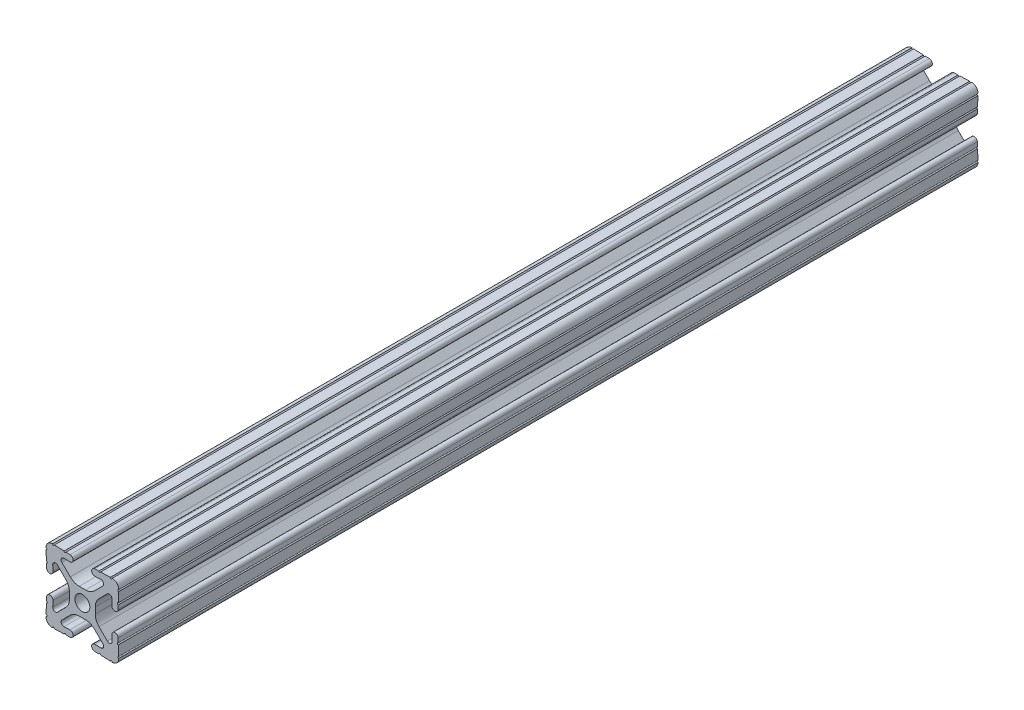
from build123d import *

# Parameters (mm, degrees)
SKETCH3_R      = 2.6035
EXTRUDE1_DEPTH = 150


with BuildPart() as part:
    # Sketch3 → Extrude1 (new, symmetric)
    with BuildSketch(Plane.XY):
        with BuildLine():
            Line((-1.115277175, 4.5085), (1.115277175, 4.5085))
            ThreePointArc((1.115277175, 4.5085), (2.806584872, 4.844922018), (4.240406305, 5.80297087))
            Line((4.240406305, 5.80297087), (7.148423664, 8.710988229))
            ThreePointArc((7.148423664, 8.710988229), (7.349906316, 9.772227925), (6.436353897, 10.348636575))
            Line((6.436353897, 10.348636575), (4.381960454, 10.276895575))
            ThreePointArc((4.381960454, 10.276895575), (3.239173075, 11.342562046), (4.304839546, 12.485349424))
            Line((4.304839546, 12.485349424), (5.728246175, 12.535055879))
            ThreePointArc((5.728246175, 12.535055879), (6.054756855, 12.230579745), (6.35923299, 12.557090424))
            Line((6.35923299, 12.557090424), (9.782092278, 12.676619304))
            ThreePointArc((9.782092278, 12.676619304), (10.108602958, 12.37214317), (10.413079092, 12.69865385))
            ThreePointArc((10.413079092, 12.69865385), (12.052764565, 12.052764565), (12.69865385, 10.413079092))
            ThreePointArc((12.69865385, 10.413079092), (12.37214317, 10.108602958), (12.676619304, 9.782092278))
            Line((12.676619304, 9.782092278), (12.557090424, 6.35923299))
            ThreePointArc((12.557090424, 6.35923299), (12.230579745, 6.054756855), (12.535055879, 5.728246175))
            Line((12.535055879, 5.728246175), (12.485349424, 4.304839546))
            ThreePointArc((12.485349424, 4.304839546), (11.342562046, 3.239173075), (10.276895575, 4.381960454))
            Line((10.276895575, 4.381960454), (10.348636575, 6.436353897))
            ThreePointArc((10.348636575, 6.436353897), (9.772227925, 7.349906316), (8.710988229, 7.148423664))
            Line((8.710988229, 7.148423664), (5.80297087, 4.240406305))
            ThreePointArc((5.80297087, 4.240406305), (4.844922018, 2.806584872), (4.5085, 1.115277175))
            Line((4.5085, 1.115277175), (4.5085, -1.115277175))
            ThreePointArc((4.5085, -1.115277175), (4.844922018, -2.806584872), (5.80297087, -4.240406305))
            Line((5.80297087, -4.240406305), (8.710988229, -7.148423664))
            ThreePointArc((8.710988229, -7.148423664), (9.772227925, -7.349906316), (10.348636575, -6.436353897))
            Line((10.348636575, -6.436353897), (10.276895575, -4.381960454))
            ThreePointArc((10.276895575, -4.381960454), (11.342562046, -3.239173075), (12.485349424, -4.304839546))
            Line((12.485349424, -4.304839546), (12.535055879, -5.728246175))
            ThreePointArc((12.535055879, -5.728246175), (12.230579745, -6.054756855), (12.557090424, -6.35923299))
            Line((12.557090424, -6.35923299), (12.676619304, -9.782092278))
            ThreePointArc((12.676619304, -9.782092278), (12.37214317, -10.108602958), (12.69865385, -10.413079092))
            ThreePointArc((12.69865385, -10.413079092), (12.052764565, -12.052764565), (10.413079092, -12.69865385))
            ThreePointArc((10.413079092, -12.69865385), (10.108602958, -12.37214317), (9.782092278, -12.676619304))
            Line((9.782092278, -12.676619304), (6.35923299, -12.557090424))
            ThreePointArc((6.35923299, -12.557090424), (6.054756855, -12.230579745), (5.728246175, -12.535055879))
            Line((5.728246175, -12.535055879), (4.304839546, -12.485349424))
            ThreePointArc((4.304839546, -12.485349424), (3.239173075, -11.342562046), (4.381960454, -10.276895575))
            Line((4.381960454, -10.276895575), (6.436353897, -10.348636575))
            ThreePointArc((6.436353897, -10.348636575), (7.349906316, -9.772227925), (7.148423664, -8.710988229))
            Line((7.148423664, -8.710988229), (4.240406305, -5.80297087))
            ThreePointArc((4.240406305, -5.80297087), (2.806584872, -4.844922018), (1.115277175, -4.5085))
            Line((1.115277175, -4.5085), (-1.115277175, -4.5085))
            ThreePointArc((-1.115277175, -4.5085), (-2.806584872, -4.844922018), (-4.240406305, -5.80297087))
            Line((-4.240406305, -5.80297087), (-7.148423664, -8.710988229))
            ThreePointArc((-7.148423664, -8.710988229), (-7.349906316, -9.772227925), (-6.436353897, -10.348636575))
            Line((-6.436353897, -10.348636575), (-4.381960454, -10.276895575))
            ThreePointArc((-4.381960454, -10.276895575), (-3.239173075, -11.342562046), (-4.304839546, -12.485349424))
            Line((-4.304839546, -12.485349424), (-5.728246175, -12.535055879))
            ThreePointArc((-5.728246175, -12.535055879), (-6.054756855, -12.230579745), (-6.35923299, -12.557090424))
            Line((-6.35923299, -12.557090424), (-9.782092278, -12.676619304))
            ThreePointArc((-9.782092278, -12.676619304), (-10.108602958, -12.37214317), (-10.413079092, -12.69865385))
            ThreePointArc((-10.413079092, -12.69865385), (-12.052764565, -12.052764565), (-12.69865385, -10.413079092))
            ThreePointArc((-12.69865385, -10.413079092), (-12.37214317, -10.108602958), (-12.676619304, -9.782092278))
            Line((-12.676619304, -9.782092278), (-12.557090424, -6.35923299))
            ThreePointArc((-12.557090424, -6.35923299), (-12.230579745, -6.054756855), (-12.535055879, -5.728246175))
            Line((-12.535055879, -5.728246175), (-12.485349424, -4.304839546))
            ThreePointArc((-12.485349424, -4.304839546), (-11.342562046, -3.239173075), (-10.276895575, -4.381960454))
            Line((-10.276895575, -4.381960454), (-10.348636575, -6.436353897))
            ThreePointArc((-10.348636575, -6.436353897), (-9.772227925, -7.349906316), (-8.710988229, -7.148423664))
            Line((-8.710988229, -7.148423664), (-5.80297087, -4.240406305))
            ThreePointArc((-5.80297087, -4.240406305), (-4.844922018, -2.806584872), (-4.5085, -1.115277175))
            Line((-4.5085, -1.115277175), (-4.5085, 1.115277175))
            ThreePointArc((-4.5085, 1.115277175), (-4.844922018, 2.806584872), (-5.80297087, 4.240406305))
            Line((-5.80297087, 4.240406305), (-8.710988229, 7.148423664))
            ThreePointArc((-8.710988229, 7.148423664), (-9.772227925, 7.349906316), (-10.348636575, 6.436353897))
            Line((-10.348636575, 6.436353897), (-10.276895575, 4.381960454))
            ThreePointArc((-10.276895575, 4.381960454), (-11.342562046, 3.239173075), (-12.485349424, 4.304839546))
            Line((-12.485349424, 4.304839546), (-12.535055879, 5.728246175))
            ThreePointArc((-12.535055879, 5.728246175), (-12.230579745, 6.054756855), (-12.557090424, 6.35923299))
            Line((-12.557090424, 6.35923299), (-12.676619304, 9.782092278))
            ThreePointArc((-12.676619304, 9.782092278), (-12.37214317, 10.108602958), (-12.69865385, 10.413079092))
            ThreePointArc((-12.69865385, 10.413079092), (-12.052764565, 12.052764565), (-10.413079092, 12.69865385))
            ThreePointArc((-10.413079092, 12.69865385), (-10.108602958, 12.37214317), (-9.782092278, 12.676619304))
            Line((-9.782092278, 12.676619304), (-6.35923299, 12.557090424))
            ThreePointArc((-6.35923299, 12.557090424), (-6.054756855, 12.230579745), (-5.728246175, 12.535055879))
            Line((-5.728246175, 12.535055879), (-4.304839546, 12.485349424))
            ThreePointArc((-4.304839546, 12.485349424), (-3.239173075, 11.342562046), (-4.381960454, 10.276895575))
            Line((-4.381960454, 10.276895575), (-6.436353897, 10.348636575))
            ThreePointArc((-6.436353897, 10.348636575), (-7.349906316, 9.772227925), (-7.148423664, 8.710988229))
            Line((-7.148423664, 8.710988229), (-4.240406305, 5.80297087))
            ThreePointArc((-4.240406305, 5.80297087), (-2.806584872, 4.844922018), (-1.115277175, 4.5085))
        make_face()
        Circle(SKETCH3_R, mode=Mode.SUBTRACT)
    extrude(amount=EXTRUDE1_DEPTH, both=True)


solid = part.part
